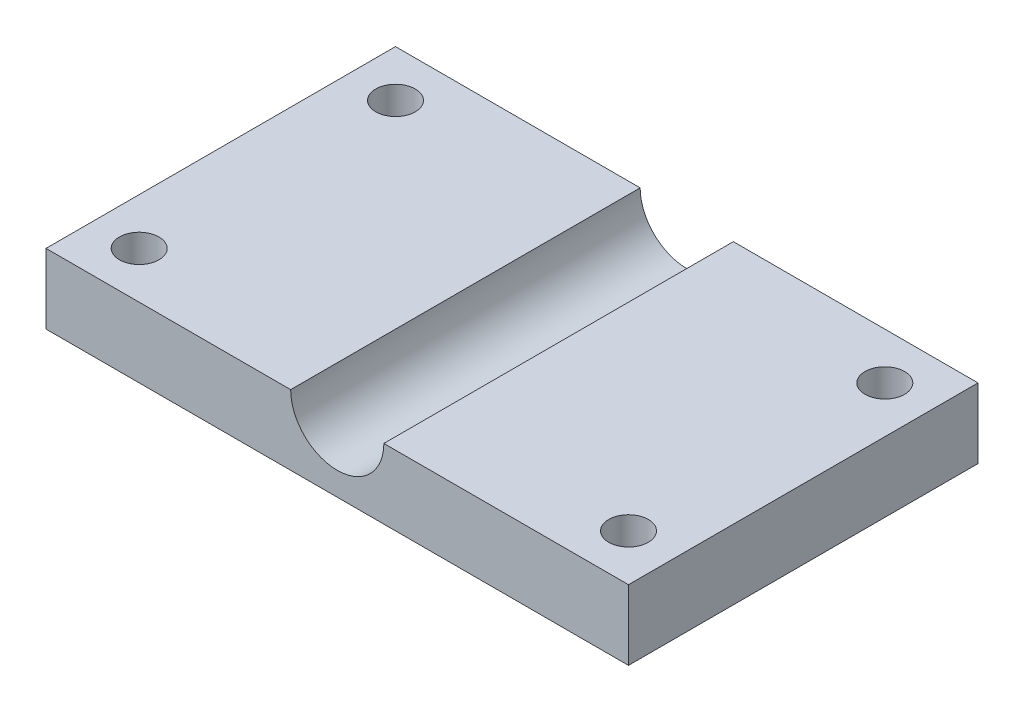
from build123d import *

# Parameters (mm, degrees)
SCHIZZO1_W                   = 50
SCHIZZO1_H                   = 30
ESTRUSIONE_ESTRUSIONE1_DEPTH = 6
SCHIZZO2_R                   = 4
TAGLIO_ESTRUSIONE1_DEPTH     = 42.646332289
SCHIZZO3_R                   = 1.7
TAGLIO_ESTRUSIONE2_DEPTH     = 10


with BuildPart() as part:
    # Schizzo1 → Estrusione-Estrusione1 (new body)
    with BuildSketch(Plane(origin=(0, 0, 0), x_dir=(1, 0, 0), z_dir=(0, 1, 0))):
        with Locations((3.256273518, 0.703517588)):
            Rectangle(SCHIZZO1_W, SCHIZZO1_H)
    extrude(amount=ESTRUSIONE_ESTRUSIONE1_DEPTH)

    # Schizzo2 → Taglio-Estrusione1 (cut, through all)
    with BuildSketch(Plane.XY.offset(14.296482412)):
        with Locations((3.256273518, 6)):
            Circle(SCHIZZO2_R)
    extrude(amount=-TAGLIO_ESTRUSIONE1_DEPTH, mode=Mode.SUBTRACT)

    # Schizzo3 → Taglio-Estrusione2 (cut)
    with BuildSketch(Plane.XZ):
        with Locations(Location((-17.743726482, 10.296482412, 0), (0, 0, 270))):
            Circle(SCHIZZO3_R)
        with Locations(Location((24.256273518, 10.296482412, 0), (0, 0, 90))):
            Circle(SCHIZZO3_R)
        with Locations(Location((24.256273518, -11.703517588, 0), (0, 0, 270))):
            Circle(SCHIZZO3_R)
        with Locations(Location((-17.743726482, -11.703517588, 0), (0, 0, 90))):
            Circle(SCHIZZO3_R)
    extrude(amount=-TAGLIO_ESTRUSIONE2_DEPTH, mode=Mode.SUBTRACT)


solid = part.part
